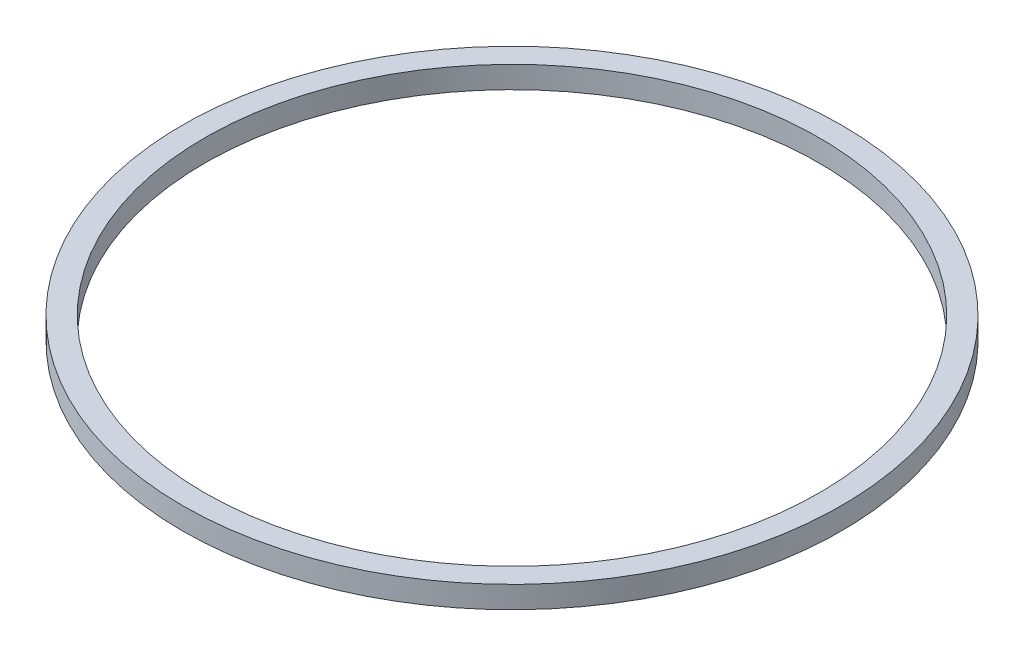
from build123d import *

# Parameters (mm, degrees)
SKETCH_1_R      = 190.6
SKETCH_1_R_2    = 177.8
EXTRUDE_1_DEPTH = 12.7


with BuildPart() as part:
    # 草图1 → 凸台-拉伸1 (new body)
    with BuildSketch(Plane(origin=(0, 0, 0), x_dir=(1, 0, 0), z_dir=(0, 1, 0))):
        with Locations(Location((0, 0, 0), (0, 0, 270))):
            Circle(SKETCH_1_R)
        with Locations(Location((0, 0, 0), (0, 0, 270))):
            Circle(SKETCH_1_R_2, mode=Mode.SUBTRACT)
    extrude(amount=EXTRUDE_1_DEPTH)


solid = part.part
